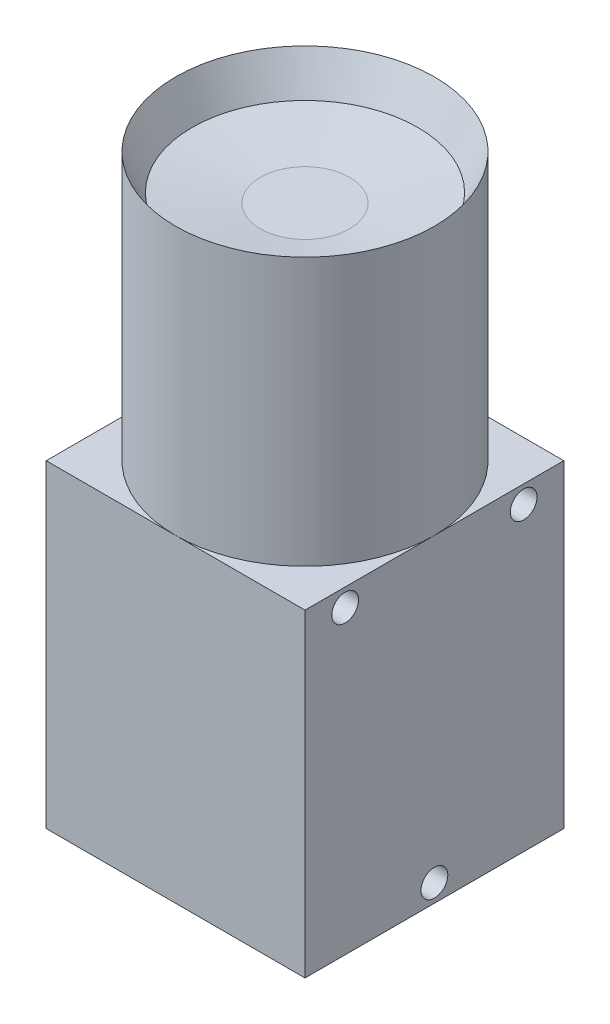
from build123d import *

# Parameters (mm, degrees)
SKETCH_2_W          = 29
SKETCH_2_H          = 29
EXTRUDE_1_DEPTH     = 35.7
SKETCH_3_R          = 1.5
CUT_EXTRUDE_1_DEPTH = 4
CUT_EXTRUDE_2_REACH = 50.226
SKETCH_4_R          = 1.5


with BuildPart() as part:
    # 草图1 → 旋转1 (revolve)
    with BuildSketch(Plane.XY):
        Polygon((0, 0), (-14.5, 0), (-14.5, 30), (-12.646873789, 26.018036841), (-5, 25), (0, 25), align=None)
    revolve(axis=Axis((0, 25, 0), (0, -1, 0)))

    # 草图2 → 凸台-拉伸1 (add)
    with BuildSketch(Plane.XZ):
        Rectangle(SKETCH_2_W, SKETCH_2_H)
    extrude(amount=EXTRUDE_1_DEPTH)

    # 草图3 → 切除-拉伸1 (cut)
    with BuildSketch(Plane(origin=(0, 0, -14.5), x_dir=(-1, 0, 0), z_dir=(0, 0, -1))):
        with Locations((-10, -2)):
            Circle(SKETCH_3_R)
        with Locations((-10, -33.7)):
            Circle(SKETCH_3_R)
        with Locations(Location((10, -33.7, 0), (0, 0, 180))):
            Circle(SKETCH_3_R)
        with Locations(Location((10, -2, 0), (0, 0, 180))):
            Circle(SKETCH_3_R)
    extrude(amount=-CUT_EXTRUDE_1_DEPTH, mode=Mode.SUBTRACT)

    # 草图4 → 切除-拉伸2 (cut, up to next)
    with BuildSketch(Plane(origin=(14.5, 0, 0), x_dir=(0, 0, -1), z_dir=(1, 0, 0)), mode=Mode.PRIVATE) as cut_extrude_2_sk1:
        with Locations(Location((-10, -2, 0), (0, 0, 90))):
            Circle(SKETCH_4_R)
    cut_extrude_2_tool1 = extrude(cut_extrude_2_sk1.sketch, amount=-CUT_EXTRUDE_2_REACH, mode=Mode.PRIVATE) & part.part
    # 草图4 → 切除-拉伸2 (cut, up to next)
    with BuildSketch(Plane(origin=(14.5, 0, 0), x_dir=(0, 0, -1), z_dir=(1, 0, 0)), mode=Mode.PRIVATE) as cut_extrude_2_sk2:
        with Locations(Location((0, -33.7, 0), (0, 0, 90))):
            Circle(SKETCH_4_R)
    cut_extrude_2_tool2 = extrude(cut_extrude_2_sk2.sketch, amount=-CUT_EXTRUDE_2_REACH, mode=Mode.PRIVATE) & part.part
    # 草图4 → 切除-拉伸2 (cut, up to next)
    with BuildSketch(Plane(origin=(14.5, 0, 0), x_dir=(0, 0, -1), z_dir=(1, 0, 0)), mode=Mode.PRIVATE) as cut_extrude_2_sk3:
        with Locations(Location((10, -2, 0), (0, 0, 90))):
            Circle(SKETCH_4_R)
    cut_extrude_2_tool3 = extrude(cut_extrude_2_sk3.sketch, amount=-CUT_EXTRUDE_2_REACH, mode=Mode.PRIVATE) & part.part
    add(cut_extrude_2_tool1.solids().sort_by_distance((14.5, -2, 10))[0], mode=Mode.SUBTRACT)
    add(cut_extrude_2_tool2.solids().sort_by_distance((14.5, -33.7, 0))[0], mode=Mode.SUBTRACT)
    add(cut_extrude_2_tool3.solids().sort_by_distance((14.5, -2, -10))[0], mode=Mode.SUBTRACT)


solid = part.part
